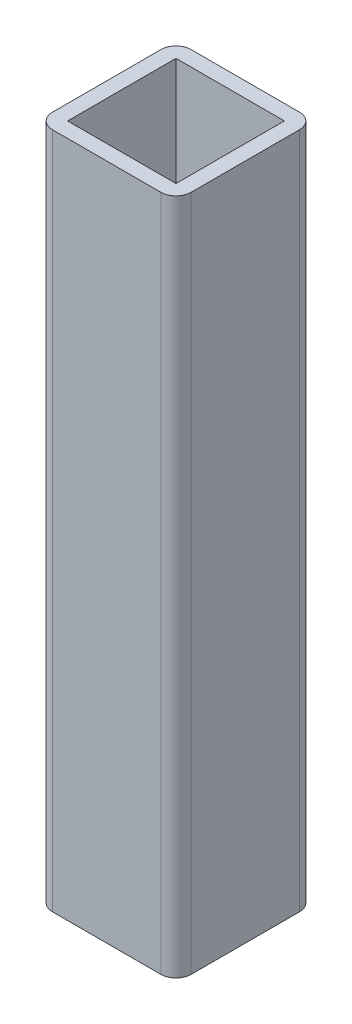
from build123d import *

# Parameters (mm, degrees)
BOSS_EXTRUDE1_DEPTH      = 65
BOSS_EXTRUDE1_DEPTH_BACK = 60
SKETCH3_W                = 20
SKETCH3_H                = 20
CUT_EXTRUDE1_DEPTH       = 1040.5


with BuildPart() as part:
    # Sketch1 → Boss-Extrude1 (new, two sides: drawn at the far end of the back side and taken through both)
    with BuildSketch(Plane(origin=(0, 0, 0), x_dir=(1, 0, 0), z_dir=(0, 1, 0)).offset(-BOSS_EXTRUDE1_DEPTH_BACK)):
        with BuildLine():
            Line((2.8, 0), (22.8, 0))
            ThreePointArc((22.8, 0), (24.779898987, -0.820101013), (25.6, -2.8))
            Line((25.6, -2.8), (25.6, -22.8))
            ThreePointArc((25.6, -22.8), (24.779898987, -24.779898987), (22.8, -25.6))
            Line((22.8, -25.6), (2.8, -25.6))
            ThreePointArc((2.8, -25.6), (0.820101013, -24.779898987), (0, -22.8))
            Line((0, -22.8), (0, -2.8))
            ThreePointArc((0, -2.8), (0.820101013, -0.820101013), (2.8, 0))
        make_face()
    extrude(amount=BOSS_EXTRUDE1_DEPTH + BOSS_EXTRUDE1_DEPTH_BACK)

    # Sketch3 → Cut-Extrude1 (cut)
    with BuildSketch(Plane(origin=(0, -60, 0), x_dir=(-1, 0, 0), z_dir=(0, -1, 0))):
        with Locations((-12.8, -12.8)):
            Rectangle(SKETCH3_W, SKETCH3_H)
    extrude(amount=-CUT_EXTRUDE1_DEPTH, mode=Mode.SUBTRACT)


solid = part.part
